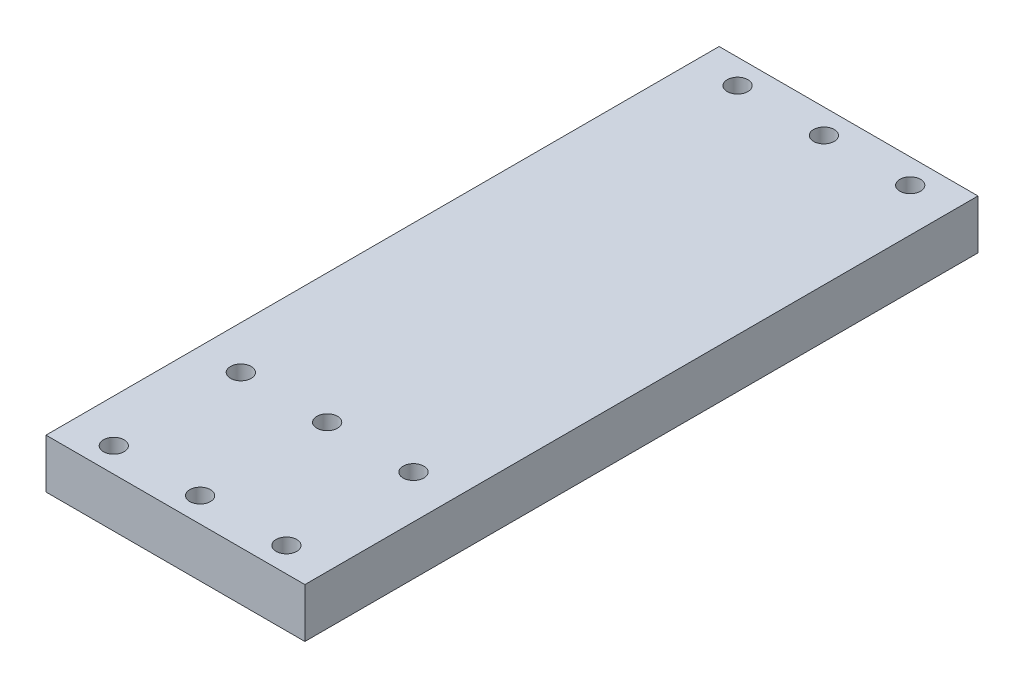
from build123d import *

# Parameters (mm, degrees)
SKETCH2_W             = 50
SKETCH2_H             = 130
BOSS_EXTRUDE1_DEPTH   = 9.525
F_4_0MM_DOWEL_HOLE1_D = 4


with BuildPart() as part:
    # Sketch2 → Boss-Extrude1 (new body)
    with BuildSketch(Plane(origin=(0, 0, 0), x_dir=(1, 0, 0), z_dir=(0, 1, 0))):
        Rectangle(SKETCH2_W, SKETCH2_H)
    extrude(amount=BOSS_EXTRUDE1_DEPTH)

    # Ø4.0mm Dowel Hole1 (through all)
    with Locations(Plane(origin=(0, 9.525, 0), x_dir=(1, 0, 0), z_dir=(0, 1, 0))):
        with Locations((16.67, -60.2375), (-16.67, 60.2375), (0, 60.2375), (16.67, 60.2375), (16.67, -35.7), (0, -35.7), (-16.67, -35.7), (-16.67, -60.2375), (0, -60.2375)):
            Hole(F_4_0MM_DOWEL_HOLE1_D / 2)


solid = part.part
